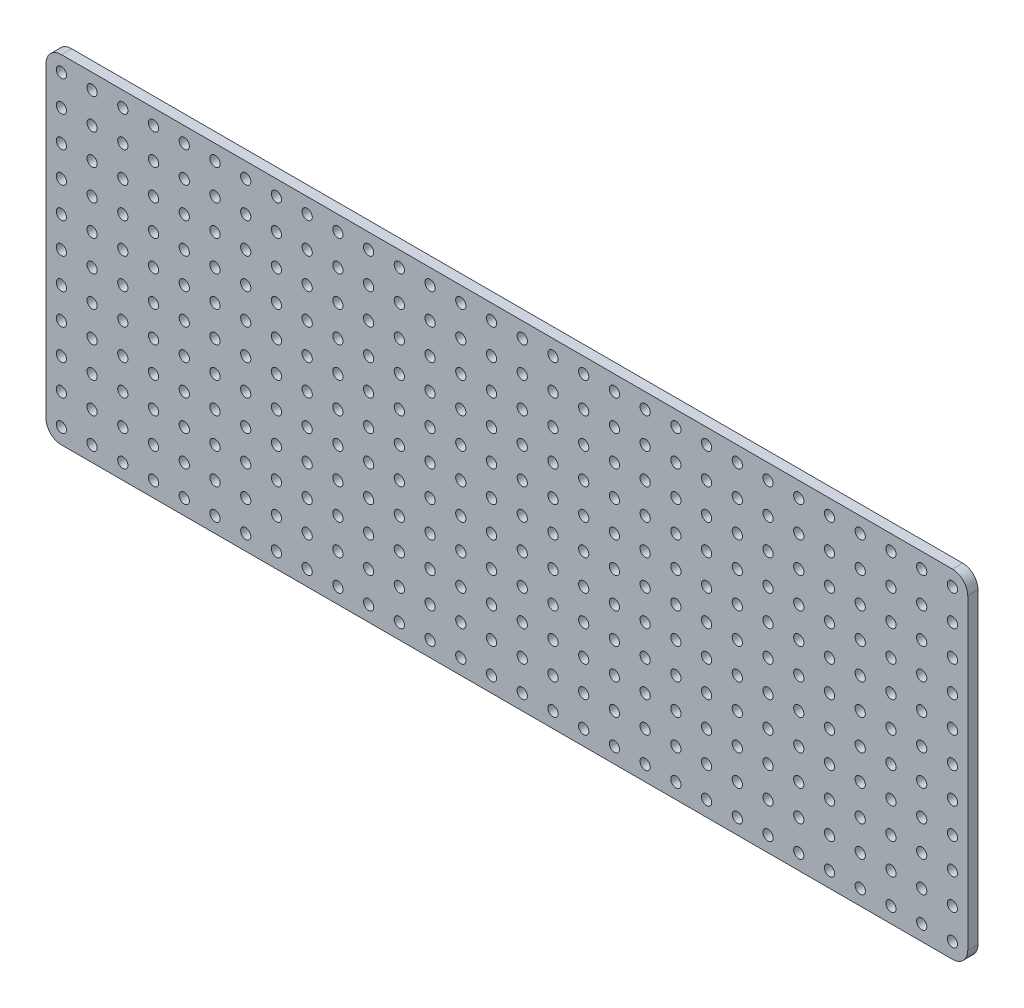
from build123d import *

# Parameters (mm, degrees)
MODEL_R                 = 1.5
SALIENTE_EXTRUIR1_DEPTH = 3


with BuildPart() as part:
    # Model → Saliente-Extruir1 (new body)
    with BuildSketch(Plane.XY):
        with BuildLine():
            Line((521.929131311, 485.242243614), (521.929131311, 395.242243614))
            ThreePointArc((521.929131311, 395.242243614), (520.611111826, 392.060263099), (517.429131311, 390.742243614))
            Line((517.429131311, 390.742243614), (256.429131311, 390.742243614))
            ThreePointArc((256.429131311, 390.742243614), (253.247150795, 392.060263099), (251.929131311, 395.242243614))
            Line((251.929131311, 395.242243614), (251.929131311, 485.242243614))
            ThreePointArc((251.929131311, 485.242243614), (253.247150795, 488.424224129), (256.429131311, 489.742243614))
            Line((256.429131311, 489.742243614), (517.429131311, 489.742243614))
            ThreePointArc((517.429131311, 489.742243614), (520.611111826, 488.424224129), (521.929131311, 485.242243614))
        make_face()
        with Locations((391.429131311, 485.242243614)):
            Circle(MODEL_R, mode=Mode.SUBTRACT)
        with Locations((391.429131311, 476.242243614)):
            Circle(MODEL_R, mode=Mode.SUBTRACT)
        with Locations((391.429131311, 467.242243614)):
            Circle(MODEL_R, mode=Mode.SUBTRACT)
        with Locations((391.429131311, 458.242243614)):
            Circle(MODEL_R, mode=Mode.SUBTRACT)
        with Locations((391.429131311, 449.242243614)):
            Circle(MODEL_R, mode=Mode.SUBTRACT)
        with Locations((391.429131311, 440.242243614)):
            Circle(MODEL_R, mode=Mode.SUBTRACT)
        with Locations((391.429131311, 431.242243614)):
            Circle(MODEL_R, mode=Mode.SUBTRACT)
        with Locations((391.429131311, 422.242243614)):
            Circle(MODEL_R, mode=Mode.SUBTRACT)
        with Locations((391.429131311, 413.242243614)):
            Circle(MODEL_R, mode=Mode.SUBTRACT)
        with Locations((391.429131311, 404.242243614)):
            Circle(MODEL_R, mode=Mode.SUBTRACT)
        with Locations((391.429131311, 395.242243614)):
            Circle(MODEL_R, mode=Mode.SUBTRACT)
        with Locations((400.429131311, 485.242243614)):
            Circle(MODEL_R, mode=Mode.SUBTRACT)
        with Locations((400.429131311, 476.242243614)):
            Circle(MODEL_R, mode=Mode.SUBTRACT)
        with Locations((400.429131311, 467.242243614)):
            Circle(MODEL_R, mode=Mode.SUBTRACT)
        with Locations((400.429131311, 458.242243614)):
            Circle(MODEL_R, mode=Mode.SUBTRACT)
        with Locations((400.429131311, 449.242243614)):
            Circle(MODEL_R, mode=Mode.SUBTRACT)
        with Locations((400.429131311, 440.242243614)):
            Circle(MODEL_R, mode=Mode.SUBTRACT)
        with Locations((400.429131311, 431.242243614)):
            Circle(MODEL_R, mode=Mode.SUBTRACT)
        with Locations((400.429131311, 422.242243614)):
            Circle(MODEL_R, mode=Mode.SUBTRACT)
        with Locations((400.429131311, 413.242243614)):
            Circle(MODEL_R, mode=Mode.SUBTRACT)
        with Locations((400.429131311, 404.242243614)):
            Circle(MODEL_R, mode=Mode.SUBTRACT)
        with Locations((400.429131311, 395.242243614)):
            Circle(MODEL_R, mode=Mode.SUBTRACT)
        with Locations((409.429131311, 485.242243614)):
            Circle(MODEL_R, mode=Mode.SUBTRACT)
        with Locations((409.429131311, 476.242243614)):
            Circle(MODEL_R, mode=Mode.SUBTRACT)
        with Locations((409.429131311, 467.242243614)):
            Circle(MODEL_R, mode=Mode.SUBTRACT)
        with Locations((409.429131311, 458.242243614)):
            Circle(MODEL_R, mode=Mode.SUBTRACT)
        with Locations((409.429131311, 449.242243614)):
            Circle(MODEL_R, mode=Mode.SUBTRACT)
        with Locations((409.429131311, 440.242243614)):
            Circle(MODEL_R, mode=Mode.SUBTRACT)
        with Locations((409.429131311, 431.242243614)):
            Circle(MODEL_R, mode=Mode.SUBTRACT)
        with Locations((409.429131311, 422.242243614)):
            Circle(MODEL_R, mode=Mode.SUBTRACT)
        with Locations((409.429131311, 413.242243614)):
            Circle(MODEL_R, mode=Mode.SUBTRACT)
        with Locations((409.429131311, 404.242243614)):
            Circle(MODEL_R, mode=Mode.SUBTRACT)
        with Locations((409.429131311, 395.242243614)):
            Circle(MODEL_R, mode=Mode.SUBTRACT)
        with Locations((418.429131311, 485.242243614)):
            Circle(MODEL_R, mode=Mode.SUBTRACT)
        with Locations((418.429131311, 476.242243614)):
            Circle(MODEL_R, mode=Mode.SUBTRACT)
        with Locations((418.429131311, 467.242243614)):
            Circle(MODEL_R, mode=Mode.SUBTRACT)
        with Locations((418.429131311, 458.242243614)):
            Circle(MODEL_R, mode=Mode.SUBTRACT)
        with Locations((418.429131311, 449.242243614)):
            Circle(MODEL_R, mode=Mode.SUBTRACT)
        with Locations((418.429131311, 440.242243614)):
            Circle(MODEL_R, mode=Mode.SUBTRACT)
        with Locations((418.429131311, 431.242243614)):
            Circle(MODEL_R, mode=Mode.SUBTRACT)
        with Locations((418.429131311, 422.242243614)):
            Circle(MODEL_R, mode=Mode.SUBTRACT)
        with Locations((418.429131311, 413.242243614)):
            Circle(MODEL_R, mode=Mode.SUBTRACT)
        with Locations((418.429131311, 404.242243614)):
            Circle(MODEL_R, mode=Mode.SUBTRACT)
        with Locations((418.429131311, 395.242243614)):
            Circle(MODEL_R, mode=Mode.SUBTRACT)
        with Locations((427.429131311, 485.242243614)):
            Circle(MODEL_R, mode=Mode.SUBTRACT)
        with Locations((427.429131311, 476.242243614)):
            Circle(MODEL_R, mode=Mode.SUBTRACT)
        with Locations((427.429131311, 467.242243614)):
            Circle(MODEL_R, mode=Mode.SUBTRACT)
        with Locations((427.429131311, 458.242243614)):
            Circle(MODEL_R, mode=Mode.SUBTRACT)
        with Locations((427.429131311, 449.242243614)):
            Circle(MODEL_R, mode=Mode.SUBTRACT)
        with Locations((427.429131311, 440.242243614)):
            Circle(MODEL_R, mode=Mode.SUBTRACT)
        with Locations((427.429131311, 431.242243614)):
            Circle(MODEL_R, mode=Mode.SUBTRACT)
        with Locations((427.429131311, 422.242243614)):
            Circle(MODEL_R, mode=Mode.SUBTRACT)
        with Locations((427.429131311, 413.242243614)):
            Circle(MODEL_R, mode=Mode.SUBTRACT)
        with Locations((427.429131311, 404.242243614)):
            Circle(MODEL_R, mode=Mode.SUBTRACT)
        with Locations((427.429131311, 395.242243614)):
            Circle(MODEL_R, mode=Mode.SUBTRACT)
        with Locations((436.429131311, 485.242243614)):
            Circle(MODEL_R, mode=Mode.SUBTRACT)
        with Locations((436.429131311, 476.242243614)):
            Circle(MODEL_R, mode=Mode.SUBTRACT)
        with Locations((436.429131311, 467.242243614)):
            Circle(MODEL_R, mode=Mode.SUBTRACT)
        with Locations((436.429131311, 458.242243614)):
            Circle(MODEL_R, mode=Mode.SUBTRACT)
        with Locations((436.429131311, 449.242243614)):
            Circle(MODEL_R, mode=Mode.SUBTRACT)
        with Locations((436.429131311, 440.242243614)):
            Circle(MODEL_R, mode=Mode.SUBTRACT)
        with Locations((436.429131311, 431.242243614)):
            Circle(MODEL_R, mode=Mode.SUBTRACT)
        with Locations((436.429131311, 422.242243614)):
            Circle(MODEL_R, mode=Mode.SUBTRACT)
        with Locations((436.429131311, 413.242243614)):
            Circle(MODEL_R, mode=Mode.SUBTRACT)
        with Locations((436.429131311, 404.242243614)):
            Circle(MODEL_R, mode=Mode.SUBTRACT)
        with Locations((436.429131311, 395.242243614)):
            Circle(MODEL_R, mode=Mode.SUBTRACT)
        with Locations((445.429131311, 485.242243614)):
            Circle(MODEL_R, mode=Mode.SUBTRACT)
        with Locations((445.429131311, 476.242243614)):
            Circle(MODEL_R, mode=Mode.SUBTRACT)
        with Locations((445.429131311, 467.242243614)):
            Circle(MODEL_R, mode=Mode.SUBTRACT)
        with Locations((445.429131311, 458.242243614)):
            Circle(MODEL_R, mode=Mode.SUBTRACT)
        with Locations((445.429131311, 449.242243614)):
            Circle(MODEL_R, mode=Mode.SUBTRACT)
        with Locations((445.429131311, 440.242243614)):
            Circle(MODEL_R, mode=Mode.SUBTRACT)
        with Locations((445.429131311, 431.242243614)):
            Circle(MODEL_R, mode=Mode.SUBTRACT)
        with Locations((445.429131311, 422.242243614)):
            Circle(MODEL_R, mode=Mode.SUBTRACT)
        with Locations((445.429131311, 413.242243614)):
            Circle(MODEL_R, mode=Mode.SUBTRACT)
        with Locations((445.429131311, 404.242243614)):
            Circle(MODEL_R, mode=Mode.SUBTRACT)
        with Locations((445.429131311, 395.242243614)):
            Circle(MODEL_R, mode=Mode.SUBTRACT)
        with Locations((454.429131311, 485.242243614)):
            Circle(MODEL_R, mode=Mode.SUBTRACT)
        with Locations((454.429131311, 476.242243614)):
            Circle(MODEL_R, mode=Mode.SUBTRACT)
        with Locations((454.429131311, 467.242243614)):
            Circle(MODEL_R, mode=Mode.SUBTRACT)
        with Locations((454.429131311, 458.242243614)):
            Circle(MODEL_R, mode=Mode.SUBTRACT)
        with Locations((454.429131311, 449.242243614)):
            Circle(MODEL_R, mode=Mode.SUBTRACT)
        with Locations((454.429131311, 440.242243614)):
            Circle(MODEL_R, mode=Mode.SUBTRACT)
        with Locations((454.429131311, 431.242243614)):
            Circle(MODEL_R, mode=Mode.SUBTRACT)
        with Locations((454.429131311, 422.242243614)):
            Circle(MODEL_R, mode=Mode.SUBTRACT)
        with Locations((454.429131311, 413.242243614)):
            Circle(MODEL_R, mode=Mode.SUBTRACT)
        with Locations((454.429131311, 404.242243614)):
            Circle(MODEL_R, mode=Mode.SUBTRACT)
        with Locations((454.429131311, 395.242243614)):
            Circle(MODEL_R, mode=Mode.SUBTRACT)
        with Locations((463.429131311, 485.242243614)):
            Circle(MODEL_R, mode=Mode.SUBTRACT)
        with Locations((463.429131311, 476.242243614)):
            Circle(MODEL_R, mode=Mode.SUBTRACT)
        with Locations((463.429131311, 467.242243614)):
            Circle(MODEL_R, mode=Mode.SUBTRACT)
        with Locations((463.429131311, 458.242243614)):
            Circle(MODEL_R, mode=Mode.SUBTRACT)
        with Locations((463.429131311, 449.242243614)):
            Circle(MODEL_R, mode=Mode.SUBTRACT)
        with Locations((463.429131311, 440.242243614)):
            Circle(MODEL_R, mode=Mode.SUBTRACT)
        with Locations((463.429131311, 431.242243614)):
            Circle(MODEL_R, mode=Mode.SUBTRACT)
        with Locations((463.429131311, 422.242243614)):
            Circle(MODEL_R, mode=Mode.SUBTRACT)
        with Locations((463.429131311, 413.242243614)):
            Circle(MODEL_R, mode=Mode.SUBTRACT)
        with Locations((463.429131311, 404.242243614)):
            Circle(MODEL_R, mode=Mode.SUBTRACT)
        with Locations((463.429131311, 395.242243614)):
            Circle(MODEL_R, mode=Mode.SUBTRACT)
        with Locations((472.429131311, 485.242243614)):
            Circle(MODEL_R, mode=Mode.SUBTRACT)
        with Locations((472.429131311, 476.242243614)):
            Circle(MODEL_R, mode=Mode.SUBTRACT)
        with Locations((472.429131311, 467.242243614)):
            Circle(MODEL_R, mode=Mode.SUBTRACT)
        with Locations((472.429131311, 458.242243614)):
            Circle(MODEL_R, mode=Mode.SUBTRACT)
        with Locations((472.429131311, 449.242243614)):
            Circle(MODEL_R, mode=Mode.SUBTRACT)
        with Locations((472.429131311, 440.242243614)):
            Circle(MODEL_R, mode=Mode.SUBTRACT)
        with Locations((472.429131311, 431.242243614)):
            Circle(MODEL_R, mode=Mode.SUBTRACT)
        with Locations((472.429131311, 422.242243614)):
            Circle(MODEL_R, mode=Mode.SUBTRACT)
        with Locations((472.429131311, 413.242243614)):
            Circle(MODEL_R, mode=Mode.SUBTRACT)
        with Locations((472.429131311, 404.242243614)):
            Circle(MODEL_R, mode=Mode.SUBTRACT)
        with Locations((472.429131311, 395.242243614)):
            Circle(MODEL_R, mode=Mode.SUBTRACT)
        with Locations((481.429131311, 485.242243614)):
            Circle(MODEL_R, mode=Mode.SUBTRACT)
        with Locations((481.429131311, 476.242243614)):
            Circle(MODEL_R, mode=Mode.SUBTRACT)
        with Locations((481.429131311, 467.242243614)):
            Circle(MODEL_R, mode=Mode.SUBTRACT)
        with Locations((481.429131311, 458.242243614)):
            Circle(MODEL_R, mode=Mode.SUBTRACT)
        with Locations((481.429131311, 449.242243614)):
            Circle(MODEL_R, mode=Mode.SUBTRACT)
        with Locations((481.429131311, 440.242243614)):
            Circle(MODEL_R, mode=Mode.SUBTRACT)
        with Locations((481.429131311, 431.242243614)):
            Circle(MODEL_R, mode=Mode.SUBTRACT)
        with Locations((481.429131311, 422.242243614)):
            Circle(MODEL_R, mode=Mode.SUBTRACT)
        with Locations((481.429131311, 413.242243614)):
            Circle(MODEL_R, mode=Mode.SUBTRACT)
        with Locations((481.429131311, 404.242243614)):
            Circle(MODEL_R, mode=Mode.SUBTRACT)
        with Locations((481.429131311, 395.242243614)):
            Circle(MODEL_R, mode=Mode.SUBTRACT)
        with Locations((490.429131311, 485.242243614)):
            Circle(MODEL_R, mode=Mode.SUBTRACT)
        with Locations((490.429131311, 476.242243614)):
            Circle(MODEL_R, mode=Mode.SUBTRACT)
        with Locations((490.429131311, 467.242243614)):
            Circle(MODEL_R, mode=Mode.SUBTRACT)
        with Locations((490.429131311, 458.242243614)):
            Circle(MODEL_R, mode=Mode.SUBTRACT)
        with Locations((490.429131311, 449.242243614)):
            Circle(MODEL_R, mode=Mode.SUBTRACT)
        with Locations((490.429131311, 440.242243614)):
            Circle(MODEL_R, mode=Mode.SUBTRACT)
        with Locations((490.429131311, 431.242243614)):
            Circle(MODEL_R, mode=Mode.SUBTRACT)
        with Locations((490.429131311, 422.242243614)):
            Circle(MODEL_R, mode=Mode.SUBTRACT)
        with Locations((490.429131311, 413.242243614)):
            Circle(MODEL_R, mode=Mode.SUBTRACT)
        with Locations((490.429131311, 404.242243614)):
            Circle(MODEL_R, mode=Mode.SUBTRACT)
        with Locations((490.429131311, 395.242243614)):
            Circle(MODEL_R, mode=Mode.SUBTRACT)
        with Locations((499.429131311, 485.242243614)):
            Circle(MODEL_R, mode=Mode.SUBTRACT)
        with Locations((499.429131311, 476.242243614)):
            Circle(MODEL_R, mode=Mode.SUBTRACT)
        with Locations((499.429131311, 467.242243614)):
            Circle(MODEL_R, mode=Mode.SUBTRACT)
        with Locations((499.429131311, 458.242243614)):
            Circle(MODEL_R, mode=Mode.SUBTRACT)
        with Locations((499.429131311, 449.242243614)):
            Circle(MODEL_R, mode=Mode.SUBTRACT)
        with Locations((499.429131311, 440.242243614)):
            Circle(MODEL_R, mode=Mode.SUBTRACT)
        with Locations((499.429131311, 431.242243614)):
            Circle(MODEL_R, mode=Mode.SUBTRACT)
        with Locations((499.429131311, 422.242243614)):
            Circle(MODEL_R, mode=Mode.SUBTRACT)
        with Locations((499.429131311, 413.242243614)):
            Circle(MODEL_R, mode=Mode.SUBTRACT)
        with Locations((499.429131311, 404.242243614)):
            Circle(MODEL_R, mode=Mode.SUBTRACT)
        with Locations((499.429131311, 395.242243614)):
            Circle(MODEL_R, mode=Mode.SUBTRACT)
        with Locations((508.429131311, 485.242243614)):
            Circle(MODEL_R, mode=Mode.SUBTRACT)
        with Locations((508.429131311, 476.242243614)):
            Circle(MODEL_R, mode=Mode.SUBTRACT)
        with Locations((508.429131311, 467.242243614)):
            Circle(MODEL_R, mode=Mode.SUBTRACT)
        with Locations((508.429131311, 458.242243614)):
            Circle(MODEL_R, mode=Mode.SUBTRACT)
        with Locations((508.429131311, 449.242243614)):
            Circle(MODEL_R, mode=Mode.SUBTRACT)
        with Locations((508.429131311, 440.242243614)):
            Circle(MODEL_R, mode=Mode.SUBTRACT)
        with Locations((508.429131311, 431.242243614)):
            Circle(MODEL_R, mode=Mode.SUBTRACT)
        with Locations((508.429131311, 422.242243614)):
            Circle(MODEL_R, mode=Mode.SUBTRACT)
        with Locations((508.429131311, 413.242243614)):
            Circle(MODEL_R, mode=Mode.SUBTRACT)
        with Locations((508.429131311, 404.242243614)):
            Circle(MODEL_R, mode=Mode.SUBTRACT)
        with Locations((508.429131311, 395.242243614)):
            Circle(MODEL_R, mode=Mode.SUBTRACT)
        with Locations((517.429131311, 485.242243614)):
            Circle(MODEL_R, mode=Mode.SUBTRACT)
        with Locations((517.429131311, 476.242243614)):
            Circle(MODEL_R, mode=Mode.SUBTRACT)
        with Locations((517.429131311, 467.242243614)):
            Circle(MODEL_R, mode=Mode.SUBTRACT)
        with Locations((517.429131311, 458.242243614)):
            Circle(MODEL_R, mode=Mode.SUBTRACT)
        with Locations((517.429131311, 449.242243614)):
            Circle(MODEL_R, mode=Mode.SUBTRACT)
        with Locations((517.429131311, 440.242243614)):
            Circle(MODEL_R, mode=Mode.SUBTRACT)
        with Locations((517.429131311, 431.242243614)):
            Circle(MODEL_R, mode=Mode.SUBTRACT)
        with Locations((517.429131311, 422.242243614)):
            Circle(MODEL_R, mode=Mode.SUBTRACT)
        with Locations((517.429131311, 413.242243614)):
            Circle(MODEL_R, mode=Mode.SUBTRACT)
        with Locations((517.429131311, 404.242243614)):
            Circle(MODEL_R, mode=Mode.SUBTRACT)
        with Locations((517.429131311, 395.242243614)):
            Circle(MODEL_R, mode=Mode.SUBTRACT)
        with Locations((256.429131311, 485.242243614)):
            Circle(MODEL_R, mode=Mode.SUBTRACT)
        with Locations((256.429131311, 476.242243614)):
            Circle(MODEL_R, mode=Mode.SUBTRACT)
        with Locations((256.429131311, 467.242243614)):
            Circle(MODEL_R, mode=Mode.SUBTRACT)
        with Locations((256.429131311, 458.242243614)):
            Circle(MODEL_R, mode=Mode.SUBTRACT)
        with Locations((256.429131311, 449.242243614)):
            Circle(MODEL_R, mode=Mode.SUBTRACT)
        with Locations((256.429131311, 440.242243614)):
            Circle(MODEL_R, mode=Mode.SUBTRACT)
        with Locations((256.429131311, 431.242243614)):
            Circle(MODEL_R, mode=Mode.SUBTRACT)
        with Locations((256.429131311, 422.242243614)):
            Circle(MODEL_R, mode=Mode.SUBTRACT)
        with Locations((256.429131311, 413.242243614)):
            Circle(MODEL_R, mode=Mode.SUBTRACT)
        with Locations((256.429131311, 404.242243614)):
            Circle(MODEL_R, mode=Mode.SUBTRACT)
        with Locations((256.429131311, 395.242243614)):
            Circle(MODEL_R, mode=Mode.SUBTRACT)
        with Locations((265.429131311, 485.242243614)):
            Circle(MODEL_R, mode=Mode.SUBTRACT)
        with Locations((265.429131311, 476.242243614)):
            Circle(MODEL_R, mode=Mode.SUBTRACT)
        with Locations((265.429131311, 467.242243614)):
            Circle(MODEL_R, mode=Mode.SUBTRACT)
        with Locations((265.429131311, 458.242243614)):
            Circle(MODEL_R, mode=Mode.SUBTRACT)
        with Locations((265.429131311, 449.242243614)):
            Circle(MODEL_R, mode=Mode.SUBTRACT)
        with Locations((265.429131311, 440.242243614)):
            Circle(MODEL_R, mode=Mode.SUBTRACT)
        with Locations((265.429131311, 431.242243614)):
            Circle(MODEL_R, mode=Mode.SUBTRACT)
        with Locations((265.429131311, 422.242243614)):
            Circle(MODEL_R, mode=Mode.SUBTRACT)
        with Locations((265.429131311, 413.242243614)):
            Circle(MODEL_R, mode=Mode.SUBTRACT)
        with Locations((265.429131311, 404.242243614)):
            Circle(MODEL_R, mode=Mode.SUBTRACT)
        with Locations((265.429131311, 395.242243614)):
            Circle(MODEL_R, mode=Mode.SUBTRACT)
        with Locations((274.429131311, 485.242243614)):
            Circle(MODEL_R, mode=Mode.SUBTRACT)
        with Locations((274.429131311, 476.242243614)):
            Circle(MODEL_R, mode=Mode.SUBTRACT)
        with Locations((274.429131311, 467.242243614)):
            Circle(MODEL_R, mode=Mode.SUBTRACT)
        with Locations((274.429131311, 458.242243614)):
            Circle(MODEL_R, mode=Mode.SUBTRACT)
        with Locations((274.429131311, 449.242243614)):
            Circle(MODEL_R, mode=Mode.SUBTRACT)
        with Locations((274.429131311, 440.242243614)):
            Circle(MODEL_R, mode=Mode.SUBTRACT)
        with Locations((274.429131311, 431.242243614)):
            Circle(MODEL_R, mode=Mode.SUBTRACT)
        with Locations((274.429131311, 422.242243614)):
            Circle(MODEL_R, mode=Mode.SUBTRACT)
        with Locations((274.429131311, 413.242243614)):
            Circle(MODEL_R, mode=Mode.SUBTRACT)
        with Locations((274.429131311, 404.242243614)):
            Circle(MODEL_R, mode=Mode.SUBTRACT)
        with Locations((274.429131311, 395.242243614)):
            Circle(MODEL_R, mode=Mode.SUBTRACT)
        with Locations((283.429131311, 485.242243614)):
            Circle(MODEL_R, mode=Mode.SUBTRACT)
        with Locations((283.429131311, 476.242243614)):
            Circle(MODEL_R, mode=Mode.SUBTRACT)
        with Locations((283.429131311, 467.242243614)):
            Circle(MODEL_R, mode=Mode.SUBTRACT)
        with Locations((283.429131311, 458.242243614)):
            Circle(MODEL_R, mode=Mode.SUBTRACT)
        with Locations((283.429131311, 449.242243614)):
            Circle(MODEL_R, mode=Mode.SUBTRACT)
        with Locations((283.429131311, 440.242243614)):
            Circle(MODEL_R, mode=Mode.SUBTRACT)
        with Locations((283.429131311, 431.242243614)):
            Circle(MODEL_R, mode=Mode.SUBTRACT)
        with Locations((283.429131311, 422.242243614)):
            Circle(MODEL_R, mode=Mode.SUBTRACT)
        with Locations((283.429131311, 413.242243614)):
            Circle(MODEL_R, mode=Mode.SUBTRACT)
        with Locations((283.429131311, 404.242243614)):
            Circle(MODEL_R, mode=Mode.SUBTRACT)
        with Locations((283.429131311, 395.242243614)):
            Circle(MODEL_R, mode=Mode.SUBTRACT)
        with Locations((292.429131311, 485.242243614)):
            Circle(MODEL_R, mode=Mode.SUBTRACT)
        with Locations((292.429131311, 476.242243614)):
            Circle(MODEL_R, mode=Mode.SUBTRACT)
        with Locations((292.429131311, 467.242243614)):
            Circle(MODEL_R, mode=Mode.SUBTRACT)
        with Locations((292.429131311, 458.242243614)):
            Circle(MODEL_R, mode=Mode.SUBTRACT)
        with Locations((292.429131311, 449.242243614)):
            Circle(MODEL_R, mode=Mode.SUBTRACT)
        with Locations((292.429131311, 440.242243614)):
            Circle(MODEL_R, mode=Mode.SUBTRACT)
        with Locations((292.429131311, 431.242243614)):
            Circle(MODEL_R, mode=Mode.SUBTRACT)
        with Locations((292.429131311, 422.242243614)):
            Circle(MODEL_R, mode=Mode.SUBTRACT)
        with Locations((292.429131311, 413.242243614)):
            Circle(MODEL_R, mode=Mode.SUBTRACT)
        with Locations((292.429131311, 404.242243614)):
            Circle(MODEL_R, mode=Mode.SUBTRACT)
        with Locations((292.429131311, 395.242243614)):
            Circle(MODEL_R, mode=Mode.SUBTRACT)
        with Locations((301.429131311, 485.242243614)):
            Circle(MODEL_R, mode=Mode.SUBTRACT)
        with Locations((301.429131311, 476.242243614)):
            Circle(MODEL_R, mode=Mode.SUBTRACT)
        with Locations((301.429131311, 467.242243614)):
            Circle(MODEL_R, mode=Mode.SUBTRACT)
        with Locations((301.429131311, 458.242243614)):
            Circle(MODEL_R, mode=Mode.SUBTRACT)
        with Locations((301.429131311, 449.242243614)):
            Circle(MODEL_R, mode=Mode.SUBTRACT)
        with Locations((301.429131311, 440.242243614)):
            Circle(MODEL_R, mode=Mode.SUBTRACT)
        with Locations((301.429131311, 431.242243614)):
            Circle(MODEL_R, mode=Mode.SUBTRACT)
        with Locations((301.429131311, 422.242243614)):
            Circle(MODEL_R, mode=Mode.SUBTRACT)
        with Locations((301.429131311, 413.242243614)):
            Circle(MODEL_R, mode=Mode.SUBTRACT)
        with Locations((301.429131311, 404.242243614)):
            Circle(MODEL_R, mode=Mode.SUBTRACT)
        with Locations((301.429131311, 395.242243614)):
            Circle(MODEL_R, mode=Mode.SUBTRACT)
        with Locations((310.429131311, 485.242243614)):
            Circle(MODEL_R, mode=Mode.SUBTRACT)
        with Locations((310.429131311, 476.242243614)):
            Circle(MODEL_R, mode=Mode.SUBTRACT)
        with Locations((310.429131311, 467.242243614)):
            Circle(MODEL_R, mode=Mode.SUBTRACT)
        with Locations((310.429131311, 458.242243614)):
            Circle(MODEL_R, mode=Mode.SUBTRACT)
        with Locations((310.429131311, 449.242243614)):
            Circle(MODEL_R, mode=Mode.SUBTRACT)
        with Locations((310.429131311, 440.242243614)):
            Circle(MODEL_R, mode=Mode.SUBTRACT)
        with Locations((310.429131311, 431.242243614)):
            Circle(MODEL_R, mode=Mode.SUBTRACT)
        with Locations((310.429131311, 422.242243614)):
            Circle(MODEL_R, mode=Mode.SUBTRACT)
        with Locations((310.429131311, 413.242243614)):
            Circle(MODEL_R, mode=Mode.SUBTRACT)
        with Locations((310.429131311, 404.242243614)):
            Circle(MODEL_R, mode=Mode.SUBTRACT)
        with Locations((310.429131311, 395.242243614)):
            Circle(MODEL_R, mode=Mode.SUBTRACT)
        with Locations((319.429131311, 485.242243614)):
            Circle(MODEL_R, mode=Mode.SUBTRACT)
        with Locations((319.429131311, 476.242243614)):
            Circle(MODEL_R, mode=Mode.SUBTRACT)
        with Locations((319.429131311, 467.242243614)):
            Circle(MODEL_R, mode=Mode.SUBTRACT)
        with Locations((319.429131311, 458.242243614)):
            Circle(MODEL_R, mode=Mode.SUBTRACT)
        with Locations((319.429131311, 449.242243614)):
            Circle(MODEL_R, mode=Mode.SUBTRACT)
        with Locations((319.429131311, 440.242243614)):
            Circle(MODEL_R, mode=Mode.SUBTRACT)
        with Locations((319.429131311, 431.242243614)):
            Circle(MODEL_R, mode=Mode.SUBTRACT)
        with Locations((319.429131311, 422.242243614)):
            Circle(MODEL_R, mode=Mode.SUBTRACT)
        with Locations((319.429131311, 413.242243614)):
            Circle(MODEL_R, mode=Mode.SUBTRACT)
        with Locations((319.429131311, 404.242243614)):
            Circle(MODEL_R, mode=Mode.SUBTRACT)
        with Locations((319.429131311, 395.242243614)):
            Circle(MODEL_R, mode=Mode.SUBTRACT)
        with Locations((328.429131311, 485.242243614)):
            Circle(MODEL_R, mode=Mode.SUBTRACT)
        with Locations((328.429131311, 476.242243614)):
            Circle(MODEL_R, mode=Mode.SUBTRACT)
        with Locations((328.429131311, 467.242243614)):
            Circle(MODEL_R, mode=Mode.SUBTRACT)
        with Locations((328.429131311, 458.242243614)):
            Circle(MODEL_R, mode=Mode.SUBTRACT)
        with Locations((328.429131311, 449.242243614)):
            Circle(MODEL_R, mode=Mode.SUBTRACT)
        with Locations((328.429131311, 440.242243614)):
            Circle(MODEL_R, mode=Mode.SUBTRACT)
        with Locations((328.429131311, 431.242243614)):
            Circle(MODEL_R, mode=Mode.SUBTRACT)
        with Locations((328.429131311, 422.242243614)):
            Circle(MODEL_R, mode=Mode.SUBTRACT)
        with Locations((328.429131311, 413.242243614)):
            Circle(MODEL_R, mode=Mode.SUBTRACT)
        with Locations((328.429131311, 404.242243614)):
            Circle(MODEL_R, mode=Mode.SUBTRACT)
        with Locations((328.429131311, 395.242243614)):
            Circle(MODEL_R, mode=Mode.SUBTRACT)
        with Locations((337.429131311, 485.242243614)):
            Circle(MODEL_R, mode=Mode.SUBTRACT)
        with Locations((337.429131311, 476.242243614)):
            Circle(MODEL_R, mode=Mode.SUBTRACT)
        with Locations((337.429131311, 467.242243614)):
            Circle(MODEL_R, mode=Mode.SUBTRACT)
        with Locations((337.429131311, 458.242243614)):
            Circle(MODEL_R, mode=Mode.SUBTRACT)
        with Locations((337.429131311, 449.242243614)):
            Circle(MODEL_R, mode=Mode.SUBTRACT)
        with Locations((337.429131311, 440.242243614)):
            Circle(MODEL_R, mode=Mode.SUBTRACT)
        with Locations((337.429131311, 431.242243614)):
            Circle(MODEL_R, mode=Mode.SUBTRACT)
        with Locations((337.429131311, 422.242243614)):
            Circle(MODEL_R, mode=Mode.SUBTRACT)
        with Locations((337.429131311, 413.242243614)):
            Circle(MODEL_R, mode=Mode.SUBTRACT)
        with Locations((337.429131311, 404.242243614)):
            Circle(MODEL_R, mode=Mode.SUBTRACT)
        with Locations((337.429131311, 395.242243614)):
            Circle(MODEL_R, mode=Mode.SUBTRACT)
        with Locations((346.429131311, 485.242243614)):
            Circle(MODEL_R, mode=Mode.SUBTRACT)
        with Locations((346.429131311, 476.242243614)):
            Circle(MODEL_R, mode=Mode.SUBTRACT)
        with Locations((346.429131311, 467.242243614)):
            Circle(MODEL_R, mode=Mode.SUBTRACT)
        with Locations((346.429131311, 458.242243614)):
            Circle(MODEL_R, mode=Mode.SUBTRACT)
        with Locations((346.429131311, 449.242243614)):
            Circle(MODEL_R, mode=Mode.SUBTRACT)
        with Locations((346.429131311, 440.242243614)):
            Circle(MODEL_R, mode=Mode.SUBTRACT)
        with Locations((346.429131311, 431.242243614)):
            Circle(MODEL_R, mode=Mode.SUBTRACT)
        with Locations((346.429131311, 422.242243614)):
            Circle(MODEL_R, mode=Mode.SUBTRACT)
        with Locations((346.429131311, 413.242243614)):
            Circle(MODEL_R, mode=Mode.SUBTRACT)
        with Locations((346.429131311, 404.242243614)):
            Circle(MODEL_R, mode=Mode.SUBTRACT)
        with Locations((346.429131311, 395.242243614)):
            Circle(MODEL_R, mode=Mode.SUBTRACT)
        with Locations((355.429131311, 485.242243614)):
            Circle(MODEL_R, mode=Mode.SUBTRACT)
        with Locations((355.429131311, 476.242243614)):
            Circle(MODEL_R, mode=Mode.SUBTRACT)
        with Locations((355.429131311, 467.242243614)):
            Circle(MODEL_R, mode=Mode.SUBTRACT)
        with Locations((355.429131311, 458.242243614)):
            Circle(MODEL_R, mode=Mode.SUBTRACT)
        with Locations((355.429131311, 449.242243614)):
            Circle(MODEL_R, mode=Mode.SUBTRACT)
        with Locations((355.429131311, 440.242243614)):
            Circle(MODEL_R, mode=Mode.SUBTRACT)
        with Locations((355.429131311, 431.242243614)):
            Circle(MODEL_R, mode=Mode.SUBTRACT)
        with Locations((355.429131311, 422.242243614)):
            Circle(MODEL_R, mode=Mode.SUBTRACT)
        with Locations((355.429131311, 413.242243614)):
            Circle(MODEL_R, mode=Mode.SUBTRACT)
        with Locations((355.429131311, 404.242243614)):
            Circle(MODEL_R, mode=Mode.SUBTRACT)
        with Locations((355.429131311, 395.242243614)):
            Circle(MODEL_R, mode=Mode.SUBTRACT)
        with Locations((364.429131311, 485.242243614)):
            Circle(MODEL_R, mode=Mode.SUBTRACT)
        with Locations((364.429131311, 476.242243614)):
            Circle(MODEL_R, mode=Mode.SUBTRACT)
        with Locations((364.429131311, 467.242243614)):
            Circle(MODEL_R, mode=Mode.SUBTRACT)
        with Locations((364.429131311, 458.242243614)):
            Circle(MODEL_R, mode=Mode.SUBTRACT)
        with Locations((364.429131311, 449.242243614)):
            Circle(MODEL_R, mode=Mode.SUBTRACT)
        with Locations((364.429131311, 440.242243614)):
            Circle(MODEL_R, mode=Mode.SUBTRACT)
        with Locations((364.429131311, 431.242243614)):
            Circle(MODEL_R, mode=Mode.SUBTRACT)
        with Locations((364.429131311, 422.242243614)):
            Circle(MODEL_R, mode=Mode.SUBTRACT)
        with Locations((364.429131311, 413.242243614)):
            Circle(MODEL_R, mode=Mode.SUBTRACT)
        with Locations((364.429131311, 404.242243614)):
            Circle(MODEL_R, mode=Mode.SUBTRACT)
        with Locations((364.429131311, 395.242243614)):
            Circle(MODEL_R, mode=Mode.SUBTRACT)
        with Locations((373.429131311, 485.242243614)):
            Circle(MODEL_R, mode=Mode.SUBTRACT)
        with Locations((373.429131311, 476.242243614)):
            Circle(MODEL_R, mode=Mode.SUBTRACT)
        with Locations((373.429131311, 467.242243614)):
            Circle(MODEL_R, mode=Mode.SUBTRACT)
        with Locations((373.429131311, 458.242243614)):
            Circle(MODEL_R, mode=Mode.SUBTRACT)
        with Locations((373.429131311, 449.242243614)):
            Circle(MODEL_R, mode=Mode.SUBTRACT)
        with Locations((373.429131311, 440.242243614)):
            Circle(MODEL_R, mode=Mode.SUBTRACT)
        with Locations((373.429131311, 431.242243614)):
            Circle(MODEL_R, mode=Mode.SUBTRACT)
        with Locations((373.429131311, 422.242243614)):
            Circle(MODEL_R, mode=Mode.SUBTRACT)
        with Locations((373.429131311, 413.242243614)):
            Circle(MODEL_R, mode=Mode.SUBTRACT)
        with Locations((373.429131311, 404.242243614)):
            Circle(MODEL_R, mode=Mode.SUBTRACT)
        with Locations((373.429131311, 395.242243614)):
            Circle(MODEL_R, mode=Mode.SUBTRACT)
        with Locations((382.429131311, 485.242243614)):
            Circle(MODEL_R, mode=Mode.SUBTRACT)
        with Locations((382.429131311, 476.242243614)):
            Circle(MODEL_R, mode=Mode.SUBTRACT)
        with Locations((382.429131311, 467.242243614)):
            Circle(MODEL_R, mode=Mode.SUBTRACT)
        with Locations((382.429131311, 458.242243614)):
            Circle(MODEL_R, mode=Mode.SUBTRACT)
        with Locations((382.429131311, 449.242243614)):
            Circle(MODEL_R, mode=Mode.SUBTRACT)
        with Locations((382.429131311, 440.242243614)):
            Circle(MODEL_R, mode=Mode.SUBTRACT)
        with Locations((382.429131311, 431.242243614)):
            Circle(MODEL_R, mode=Mode.SUBTRACT)
        with Locations((382.429131311, 422.242243614)):
            Circle(MODEL_R, mode=Mode.SUBTRACT)
        with Locations((382.429131311, 413.242243614)):
            Circle(MODEL_R, mode=Mode.SUBTRACT)
        with Locations((382.429131311, 404.242243614)):
            Circle(MODEL_R, mode=Mode.SUBTRACT)
        with Locations((382.429131311, 395.242243614)):
            Circle(MODEL_R, mode=Mode.SUBTRACT)
    extrude(amount=SALIENTE_EXTRUIR1_DEPTH)


solid = part.part
